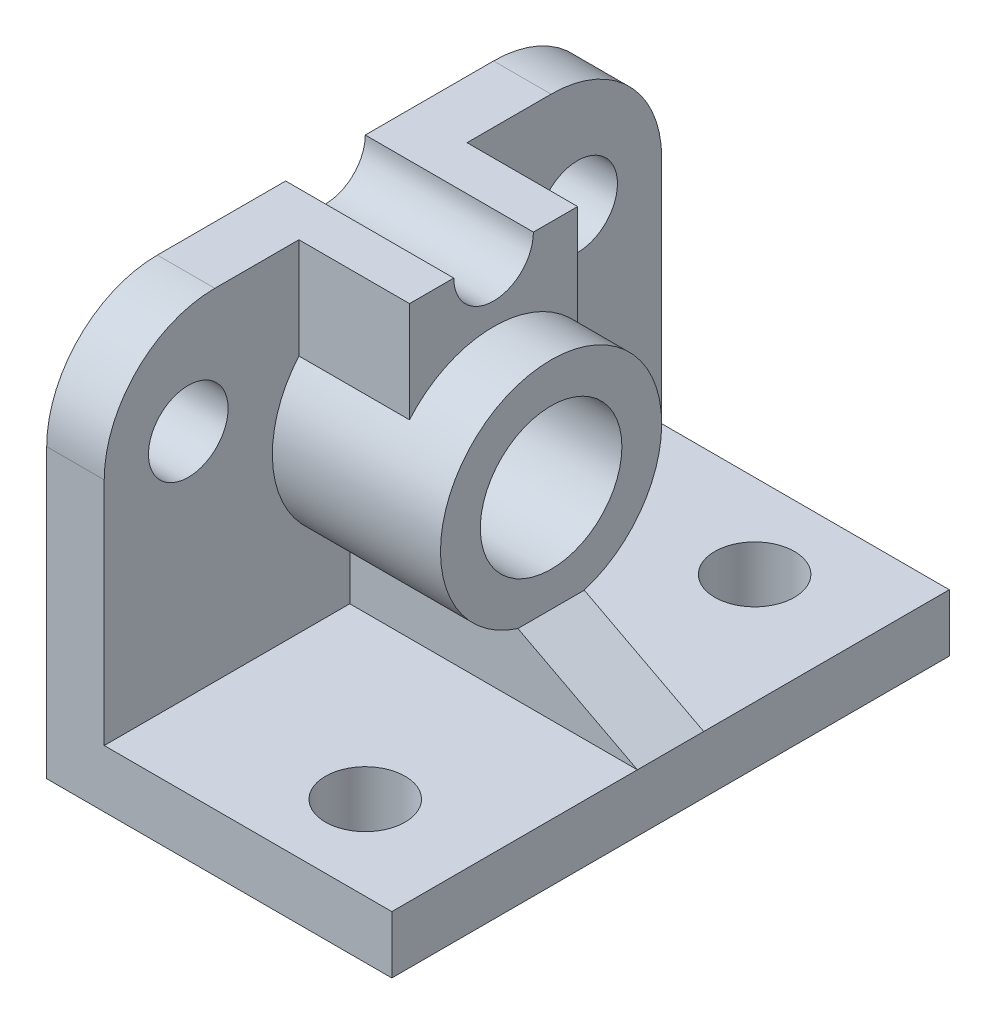
from build123d import *

# Parameters (mm, degrees)
BOSS_EXTRUDE1_DEPTH = 63
SKETCH2_R           = 16
BOSS_EXTRUDE2_DEPTH = 38
BOSS_EXTRUDE3_DEPTH = 25
CUT_EXTRUDE1_START  = -38
CUT_EXTRUDE1_DEPTH  = 38
CUT_EXTRUDE2_START  = -38
SKETCH2_5_R         = 16
CUT_EXTRUDE2_DEPTH  = 38
BOSS_EXTRUDE4_DEPTH = 65
SKETCH5_R           = 9
CUT_EXTRUDE4_DEPTH  = 38
SKETCH6_R           = 9
CUT_EXTRUDE5_DEPTH  = 38
FILLET1_R           = 25
CUT_EXTRUDE6_DEPTH  = 38


with BuildPart() as part:
    # Sketch1 → Boss-Extrude1 (new, symmetric)
    with BuildSketch(Plane.XY):
        Polygon((0, 0), (0, 90), (13, 90), (13, 13), (78, 13), (78, 0), align=None)
    extrude(amount=BOSS_EXTRUDE1_DEPTH, both=True)

    # Sketch2 → Boss-Extrude2 (add)
    with BuildSketch(Plane(origin=(13, 0, 0), x_dir=(0, 0, -1), z_dir=(1, 0, 0))):
        with BuildLine():
            ThreePointArc((19, 67.248076809), (0, 76), (-19, 67.248076809))
            ThreePointArc((-19, 67.248076809), (-24.031145784, 44.107683096), (-7.5, 27.151519965))
            Line((-7.5, 27.151519965), (7.5, 27.151519965))
            ThreePointArc((7.5, 27.151519965), (20.155644371, 36.209800542), (25, 51))
            ThreePointArc((25, 51), (23.452078799, 59.660254038), (19, 67.248076809))
        make_face()
        with Locations((0, 51)):
            Circle(SKETCH2_R, mode=Mode.SUBTRACT)
    extrude(amount=BOSS_EXTRUDE2_DEPTH)

    # Sketch2<3> → Boss-Extrude3 (add)
    with BuildSketch(Plane(origin=(13, 0, 0), x_dir=(0, 0, -1), z_dir=(1, 0, 0))):
        with BuildLine():
            Line((-9, 90), (-19, 90))
            Line((-19, 90), (-19, 67.248076809))
            ThreePointArc((-19, 67.248076809), (0, 76), (19, 67.248076809))
            Line((19, 67.248076809), (19, 90))
            Line((19, 90), (9, 90))
            ThreePointArc((9, 90), (0, 81), (-9, 90))
        make_face()
    extrude(amount=BOSS_EXTRUDE3_DEPTH)

    # Sketch2<4> → Cut-Extrude1 (cut)
    with BuildSketch(Plane(origin=(13, 0, 0), x_dir=(0, 0, -1), z_dir=(1, 0, 0)).offset(CUT_EXTRUDE1_START)):
        with BuildLine():
            Line((9, 90), (-9, 90))
            ThreePointArc((-9, 90), (0, 81), (9, 90))
        make_face()
    extrude(amount=CUT_EXTRUDE1_DEPTH, mode=Mode.SUBTRACT)

    # Sketch2<5> → Cut-Extrude2 (cut)
    with BuildSketch(Plane(origin=(13, 0, 0), x_dir=(0, 0, -1), z_dir=(1, 0, 0)).offset(CUT_EXTRUDE2_START)):
        with Locations((0, 51)):
            Circle(SKETCH2_5_R)
    extrude(amount=CUT_EXTRUDE2_DEPTH, mode=Mode.SUBTRACT)

    # Sketch2<6> → Boss-Extrude4 (add)
    with BuildSketch(Plane(origin=(13, 0, 0), x_dir=(0, 0, -1), z_dir=(1, 0, 0))):
        with BuildLine():
            ThreePointArc((7.5, 27.151519965), (0, 26), (-7.5, 27.151519965))
            Line((-7.5, 27.151519965), (-7.5, 13))
            Line((-7.5, 13), (7.5, 13))
            Line((7.5, 13), (7.5, 27.151519965))
        make_face()
        with BuildLine():
            Line((7.5, 27.151519965), (-7.5, 27.151519965))
            ThreePointArc((-7.5, 27.151519965), (0, 26), (7.5, 27.151519965))
        make_face()
    extrude(amount=BOSS_EXTRUDE4_DEPTH)

    # Sketch5 → Cut-Extrude4 (cut)
    with BuildSketch(Plane(origin=(13, 0, 0), x_dir=(0, 0, -1), z_dir=(1, 0, 0))):
        with Locations((-44, 65)):
            Circle(SKETCH5_R)
    cut_extrude4 = extrude(amount=-CUT_EXTRUDE4_DEPTH, mode=Mode.SUBTRACT)

    # Mirror1: Cut-Extrude4 across plane
    add(cut_extrude4.mirror(Plane.XY), mode=Mode.SUBTRACT)

    # Sketch6 → Cut-Extrude5 (cut)
    with BuildSketch(Plane(origin=(0, 13, 0), x_dir=(1, 0, 0), z_dir=(0, 1, 0))):
        with Locations(Location((53, -44, 0), (0, 0, 180))):
            Circle(SKETCH6_R)
    cut_extrude5 = extrude(amount=-CUT_EXTRUDE5_DEPTH, mode=Mode.SUBTRACT)

    # Mirror2: Cut-Extrude5 across plane
    add(cut_extrude5.mirror(Plane.XY), mode=Mode.SUBTRACT)

    # Fillet1
    fillet1_edges = [part.edges().sort_by_distance(p)[0] for p in [
        (6.5, 90, 63),
        (6.5, 90, -63),
    ]]
    fillet(fillet1_edges, radius=FILLET1_R)

    # Sketch7 → Cut-Extrude6 (cut)
    with BuildSketch(Plane.XY.offset(7.5)):
        Polygon((51, 27.151519965), (78, 13), (78, 27.151519965), align=None)
    extrude(amount=-CUT_EXTRUDE6_DEPTH, mode=Mode.SUBTRACT)


solid = part.part
